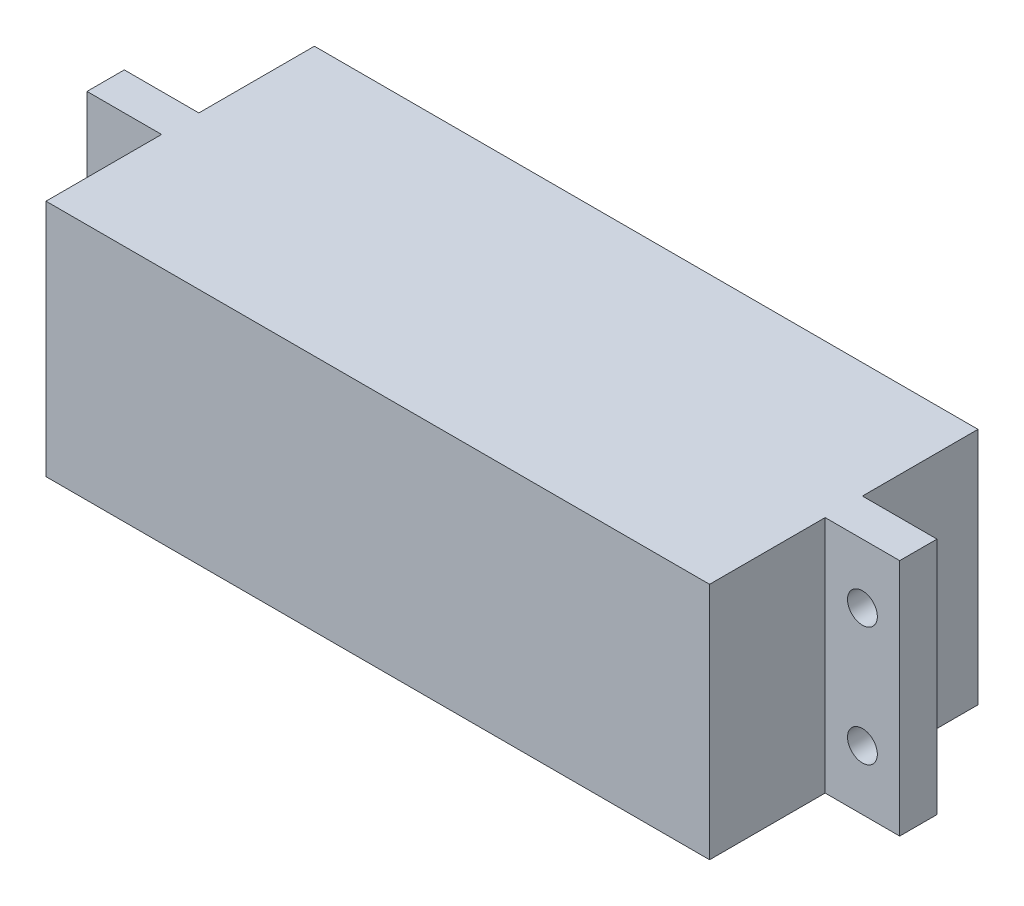
from build123d import *

# Parameters (mm, degrees)
SKETCH2_W                = 85
SKETCH2_H                = 32
BOSS_EXTRUDE1_DEPTH      = 2
EXTRUDE_THIN1_DEPTH      = 2
EXTRUDE_THIN1_DEPTH_BACK = 30
SKETCH2_2_W              = 89
SKETCH2_2_H              = 36
SKETCH2_2_W_2            = 85
SKETCH2_2_H_2            = 32
SKETCH3_W                = 5
SKETCH3_H                = 32
BOSS_EXTRUDE2_DEPTH      = 10
SKETCH4_R                = 2
CUT_EXTRUDE1_DEPTH       = 66.501908369


with BuildPart() as part:
    # Sketch2 → Boss-Extrude1 (new body)
    with BuildSketch(Plane(origin=(0, 0, 0), x_dir=(1, 0, 0), z_dir=(0, 1, 0))):
        Rectangle(SKETCH2_W, SKETCH2_H)
    extrude(amount=BOSS_EXTRUDE1_DEPTH)

    # Sketch2<2> → Extrude-Thin1 (add, two sides: drawn at the far end of the back side and taken through both)
    with BuildSketch(Plane(origin=(0, 0, 0), x_dir=(1, 0, 0), z_dir=(0, 1, 0)).offset(-EXTRUDE_THIN1_DEPTH_BACK)):
        Rectangle(SKETCH2_2_W, SKETCH2_2_H)
        Rectangle(SKETCH2_2_W_2, SKETCH2_2_H_2, mode=Mode.SUBTRACT)
    extrude(amount=EXTRUDE_THIN1_DEPTH + EXTRUDE_THIN1_DEPTH_BACK)

    # Sketch3 → Boss-Extrude2 (add)
    with BuildSketch(Plane(origin=(44.5, 0, 0), x_dir=(0, 0, -1), z_dir=(1, 0, 0))):
        with Locations((0, -14)):
            Rectangle(SKETCH3_W, SKETCH3_H)
    boss_extrude2 = extrude(amount=BOSS_EXTRUDE2_DEPTH)

    # Sketch4 → Cut-Extrude1 (cut, through all)
    with BuildSketch(Plane.XY.offset(2.5)):
        with Locations((49.5, -6)):
            Circle(SKETCH4_R)
        with Locations((49.5, -22)):
            Circle(SKETCH4_R)
    cut_extrude1 = extrude(amount=-CUT_EXTRUDE1_DEPTH, mode=Mode.SUBTRACT)

    # Mirror1: Boss-Extrude2, Cut-Extrude1 across plane
    add(boss_extrude2.mirror(Plane(origin=(0, 0, 0), x_dir=(0, 0, 1), z_dir=(1, 0, 0))))
    add(cut_extrude1.mirror(Plane(origin=(0, 0, 0), x_dir=(0, 0, 1), z_dir=(1, 0, 0))), mode=Mode.SUBTRACT)


solid = part.part
